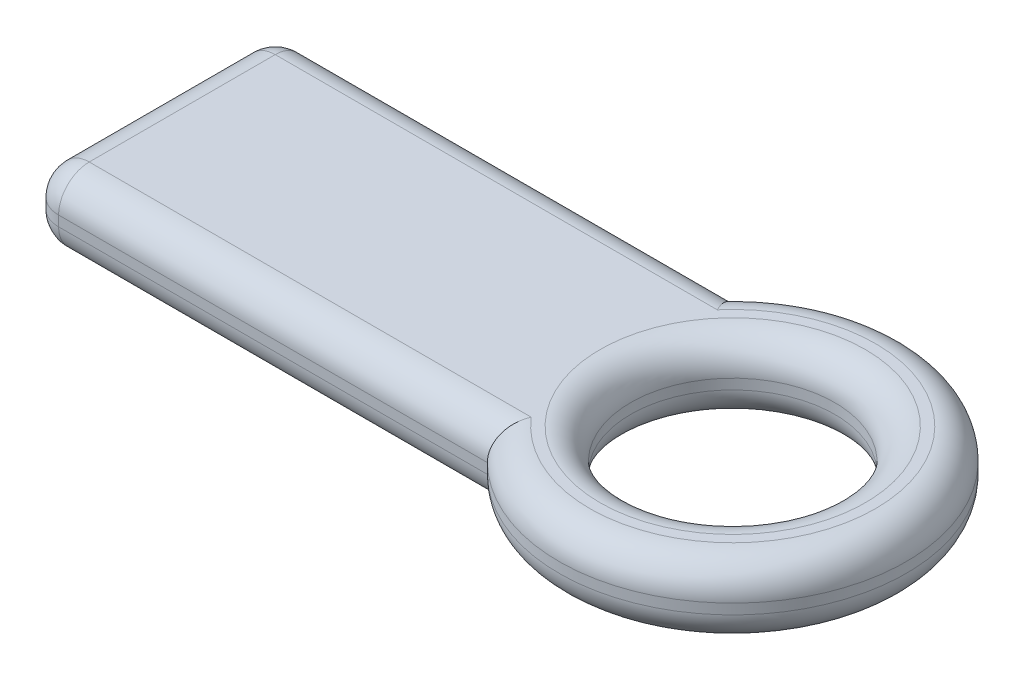
from build123d import *

# Parameters (mm, degrees)
SKETCH1_R      = 50
EXTRUDE1_DEPTH = 35
FILLET1_R      = 15
FILLET2_R      = 15


with BuildPart() as part:
    # Sketch1 → Extrude1 (new body)
    with BuildSketch(Plane(origin=(0, 0, 0), x_dir=(1, 0, 0), z_dir=(0, 1, 0))):
        with BuildLine():
            Line((0, 0), (225.000255868, 0))
            ThreePointArc((225.000255868, 0), (369.65, 60.555), (225.000255868, 121.11))
            Line((225.000255868, 121.11), (0, 121.11))
            Line((0, 121.11), (0, 0))
        make_face()
        with Locations(Location((284.65, 60.555, 0), (0, 0, 270))):
            Circle(SKETCH1_R, mode=Mode.SUBTRACT)
    extrude(amount=EXTRUDE1_DEPTH)

    # Fillet1
    fillet1_edges = [part.edges().sort_by_distance(p)[0] for p in [
        (369.65, 35, -60.555),
        (284.65, 0, -110.555),
        (284.65, 35, -110.555),
        (112.500127934, 35, -121.11),
        (112.500127934, 0, -121.11),
        (369.65, 0, -60.555),
        (112.500127934, 0, 0),
        (112.500127934, 35, 0),
    ]]
    fillet(fillet1_edges, radius=FILLET1_R)

    # Fillet2
    fillet2_edges = [part.edges().sort_by_distance(p)[0] for p in [
        (0, 17.5, -121.11),
        (0, 0, -60.555),
        (0, 17.5, 0),
        (0, 35, -60.555),
        (0, 30.606601718, -4.393398282),
        (0, 4.393398282, -4.393398282),
        (0, 30.606601718, -116.716601718),
        (0, 4.393398282, -116.716601718),
    ]]
    fillet(fillet2_edges, radius=FILLET2_R)


solid = part.part
